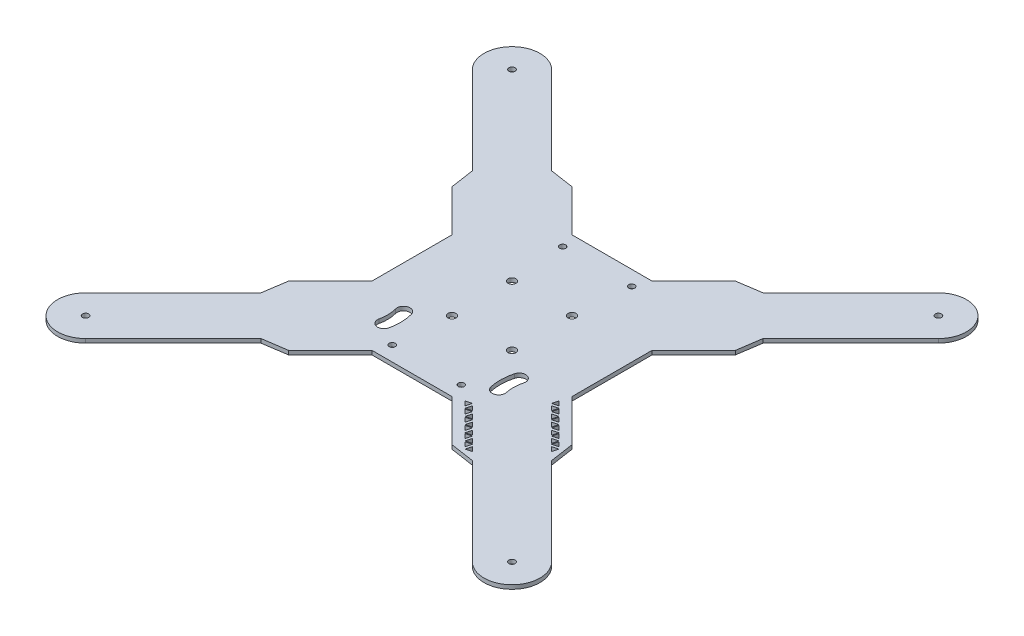
from build123d import *

# Parameters (mm, degrees)
SKETCH1_R               = 1.556
BOSS_EXTRUDE1_DEPTH     = 2
SKETCH3_R               = 2
SKETCH3_R_2             = 1.5
CUT_EXTRUDE1_DEPTH      = 10
CUT_EXTRUDE2_DEPTH      = 171.521397129
CUT_EXTRUDE2_DEPTH_BACK = 171.521397129
CUT_EXTRUDE3_DEPTH      = 171.521397129
CUT_EXTRUDE3_DEPTH_BACK = 171.521397129


with BuildPart() as part:
    # Sketch1 → Boss-Extrude1 (new body)
    with BuildSketch(Plane(origin=(0, 0, 0), x_dir=(1, 0, 0), z_dir=(0, 1, 0))):
        with BuildLine():
            Line((-70.828427125, 40.828427125), (-50, 20))
            Line((-50, 20), (-50, -20))
            Line((-50, -20), (-70.828427125, -40.828427125))
            Line((-70.828427125, -40.828427125), (-72.627416998, -52.828427125))
            Line((-72.627416998, -52.828427125), (-116.468037432, -96.669047558))
            ThreePointArc((-116.468037432, -96.669047558), (-116.468037432, -116.468037432), (-96.669047558, -116.468037432))
            Line((-96.669047558, -116.468037432), (-52.828427125, -72.627416998))
            Line((-52.828427125, -72.627416998), (-40.828427125, -70.828427125))
            Line((-40.828427125, -70.828427125), (-20, -50))
            Line((-20, -50), (20, -50))
            Line((20, -50), (40.828427125, -70.828427125))
            Line((40.828427125, -70.828427125), (52.828427125, -72.627416998))
            Line((52.828427125, -72.627416998), (96.669047558, -116.468037432))
            ThreePointArc((96.669047558, -116.468037432), (116.468037432, -116.468037432), (116.468037432, -96.669047558))
            Line((116.468037432, -96.669047558), (72.627416998, -52.828427125))
            Line((72.627416998, -52.828427125), (70.828427125, -40.828427125))
            Line((70.828427125, -40.828427125), (50, -20))
            Line((50, -20), (50, 20))
            Line((50, 20), (70.828427125, 40.828427125))
            Line((70.828427125, 40.828427125), (72.627416998, 52.828427125))
            Line((72.627416998, 52.828427125), (116.468037432, 96.669047558))
            ThreePointArc((116.468037432, 96.669047558), (116.468037432, 116.468037432), (96.669047558, 116.468037432))
            Line((96.669047558, 116.468037432), (52.828427125, 72.627416998))
            Line((52.828427125, 72.627416998), (40.828427125, 70.828427125))
            Line((40.828427125, 70.828427125), (20, 50))
            Line((20, 50), (-20, 50))
            Line((-20, 50), (-40.828427125, 70.828427125))
            Line((-40.828427125, 70.828427125), (-52.828427125, 72.627416998))
            Line((-52.828427125, 72.627416998), (-96.669047558, 116.468037432))
            ThreePointArc((-96.669047558, 116.468037432), (-116.468037432, 116.468037432), (-116.468037432, 96.669047558))
            Line((-116.468037432, 96.669047558), (-72.627416998, 52.828427125))
            Line((-72.627416998, 52.828427125), (-70.828427125, 40.828427125))
        make_face()
        with Locations(Location((-106.568542495, 106.568542495, 0), (0, 0, 270))):
            Circle(SKETCH1_R, mode=Mode.SUBTRACT)
        with Locations(Location((106.568542495, 106.568542495, 0), (0, 0, 270))):
            Circle(SKETCH1_R, mode=Mode.SUBTRACT)
        with Locations(Location((-106.568542495, -106.568542495, 0), (0, 0, 270))):
            Circle(SKETCH1_R, mode=Mode.SUBTRACT)
        with Locations(Location((106.568542495, -106.568542495, 0), (0, 0, 270))):
            Circle(SKETCH1_R, mode=Mode.SUBTRACT)
    extrude(amount=BOSS_EXTRUDE1_DEPTH)

    # Sketch3 → Cut-Extrude1 (cut)
    with BuildSketch(Plane(origin=(0, 2, 0), x_dir=(1, 0, 0), z_dir=(0, 1, 0))):
        with Locations(Location((-15, 15, 0), (0, 0, 270))):
            Circle(SKETCH3_R)
        with Locations(Location((-17.25, 42.6, 0), (0, 0, 270))):
            Circle(SKETCH3_R_2)
        with Locations(Location((15, 15, 0), (0, 0, 270))):
            Circle(SKETCH3_R)
        with Locations(Location((17.25, 42.6, 0), (0, 0, 270))):
            Circle(SKETCH3_R_2)
        with Locations(Location((15, -15, 0), (0, 0, 270))):
            Circle(SKETCH3_R)
        with Locations(Location((-15, -15, 0), (0, 0, 270))):
            Circle(SKETCH3_R)
        with Locations(Location((17.25, -42.6, 0), (0, 0, 270))):
            Circle(SKETCH3_R_2)
        with Locations(Location((-17.25, -42.6, 0), (0, 0, 270))):
            Circle(SKETCH3_R_2)
    extrude(amount=-CUT_EXTRUDE1_DEPTH, mode=Mode.SUBTRACT)

    # Sketch4 → Cut-Extrude2 (cut, two sides: drawn at the far end of the back side and taken through both)
    with BuildSketch(Plane(origin=(0, 2, 0), x_dir=(1, 0, 0), z_dir=(0, 1, 0)).offset(-CUT_EXTRUDE2_DEPTH_BACK)):
        with BuildLine():
            ThreePointArc((25.75051417, -24.493590073), (24.93554726, -30.234601125), (25.482776992, -36.007288418))
            ThreePointArc((25.482776992, -36.007288418), (29.344558273, -38.499605681), (31.836875536, -34.637824401))
            ThreePointArc((31.836875536, -34.637824401), (31.433790571, -30.385709941), (32.034088562, -26.156927943))
            ThreePointArc((32.034088562, -26.156927943), (29.723970301, -22.183471812), (25.75051417, -24.493590073))
        make_face()
        with BuildLine():
            ThreePointArc((-25.75051417, -24.493590073), (-24.93554726, -30.234601125), (-25.482776992, -36.007288418))
            ThreePointArc((-25.482776992, -36.007288418), (-29.344558273, -38.499605681), (-31.836875536, -34.637824401))
            ThreePointArc((-31.836875536, -34.637824401), (-31.433790571, -30.385709941), (-32.034088562, -26.156927943))
            ThreePointArc((-32.034088562, -26.156927943), (-29.723970301, -22.183471812), (-25.75051417, -24.493590073))
        make_face()
    extrude(amount=CUT_EXTRUDE2_DEPTH + CUT_EXTRUDE2_DEPTH_BACK, mode=Mode.SUBTRACT)

    # Sketch5 → Cut-Extrude3 (cut, two sides: drawn at the far end of the back side and taken through both)
    with BuildSketch(Plane(origin=(0, 2, 0), x_dir=(1, 0, 0), z_dir=(0, 1, 0)).offset(-CUT_EXTRUDE3_DEPTH_BACK)):
        Polygon((25.181912304, -48.655136792), (27.303232648, -50.776457135), (28.079689783, -47.878679656), align=None)
        Polygon((29.079689783, -48.878679656), (28.303232648, -51.776457135), (31.201010127, -51), align=None)
        Polygon((28.71744621, -52.190670698), (30.838766554, -54.311991041), (31.615223689, -51.414213562), align=None)
        Polygon((32.615223689, -52.414213562), (31.838766554, -55.311991041), (34.736544033, -54.535533906), align=None)
        Polygon((32.252980116, -55.726204604), (34.37430046, -57.847524947), (35.150757595, -54.949747468), align=None)
        Polygon((36.150757595, -55.949747468), (35.37430046, -58.847524947), (38.272077939, -58.071067812), align=None)
        Polygon((35.788514022, -59.26173851), (37.909834366, -61.383058853), (38.686291501, -58.485281374), align=None)
        Polygon((39.686291501, -59.485281374), (38.909834366, -62.383058853), (41.807611845, -61.606601718), align=None)
        Polygon((39.324047928, -62.797272415), (41.445368272, -64.918592759), (42.221825407, -62.02081528), align=None)
        Polygon((43.221825407, -63.02081528), (42.445368272, -65.918592759), (45.343145751, -65.142135624), align=None)
        Polygon((42.859581834, -66.332806321), (44.980902178, -68.454126665), (45.757359313, -65.556349186), align=None)
        Polygon((46.757359313, -66.556349186), (45.980902178, -69.454126665), (48.878679656, -68.67766953), align=None)
        Polygon((68.67766953, -48.878679656), (66.556349186, -46.757359313), (69.454126665, -45.980902178), align=None)
        Polygon((65.556349186, -45.757359313), (68.454126665, -44.980902178), (66.332806321, -42.859581834), align=None)
        Polygon((65.142135624, -45.343145751), (63.02081528, -43.221825407), (65.918592759, -42.445368272), align=None)
        Polygon((62.02081528, -42.221825407), (64.918592759, -41.445368272), (62.797272415, -39.324047928), align=None)
        Polygon((61.606601718, -41.807611845), (59.485281374, -39.686291501), (62.383058853, -38.909834366), align=None)
        Polygon((58.485281374, -38.686291501), (61.383058853, -37.909834366), (59.26173851, -35.788514022), align=None)
        Polygon((58.071067812, -38.272077939), (55.949747468, -36.150757595), (58.847524947, -35.37430046), align=None)
        Polygon((54.949747468, -35.150757595), (57.847524947, -34.37430046), (55.726204604, -32.252980116), align=None)
        Polygon((54.535533906, -34.736544033), (52.414213562, -32.615223689), (55.311991041, -31.838766554), align=None)
        Polygon((51.414213562, -31.615223689), (54.311991041, -30.838766554), (52.190670698, -28.71744621), align=None)
        Polygon((51, -31.201010127), (48.878679656, -29.079689783), (51.776457135, -28.303232648), align=None)
        Polygon((47.878679656, -28.079689783), (50.776457135, -27.303232648), (48.655136792, -25.181912304), align=None)
    extrude(amount=CUT_EXTRUDE3_DEPTH + CUT_EXTRUDE3_DEPTH_BACK, mode=Mode.SUBTRACT)


solid = part.part
